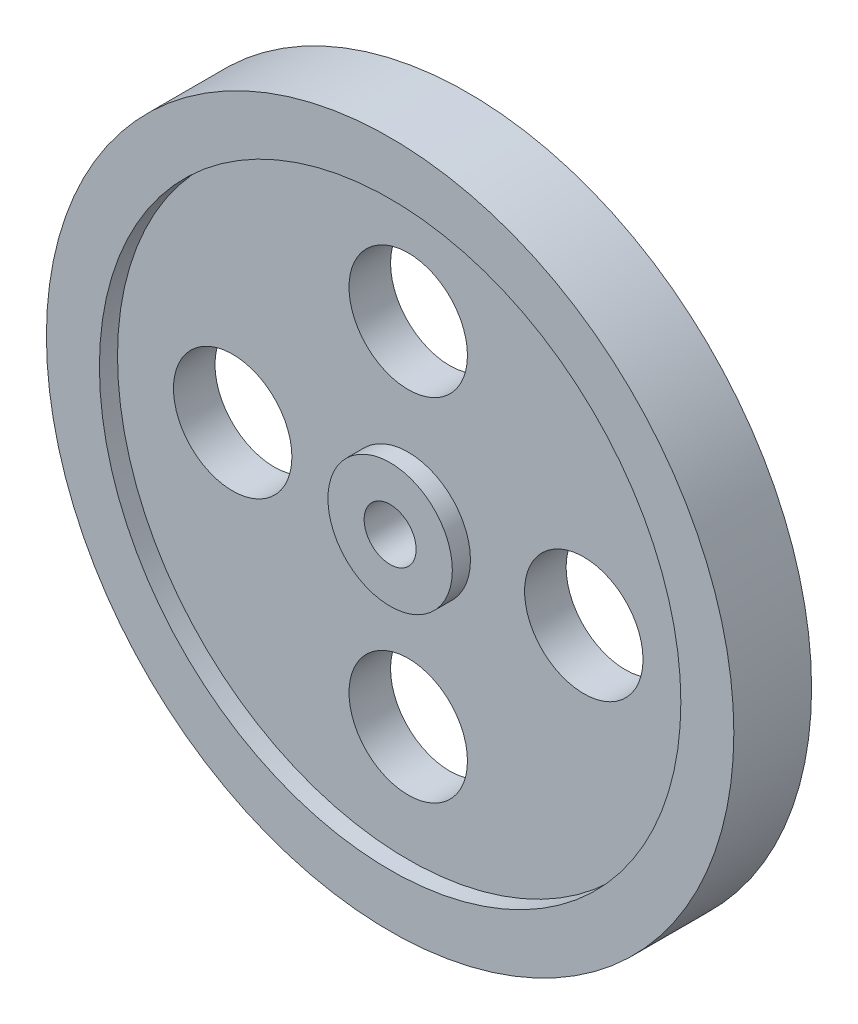
from build123d import *

# Parameters (mm, degrees)
SKETCH1_R           = 24.66826923
SKETCH1_R_2         = 1.8669
BOSS_EXTRUDE1_DEPTH = 2.79
SKETCH2_R           = 20.865
SKETCH2_R_2         = 4.465
CUT_EXTRUDE1_DEPTH  = 1.3
SKETCH3_R           = 4.25
CUT_EXTRUDE2_DEPTH  = 36.147765414


with BuildPart() as part:
    # Sketch1 → Boss-Extrude1 (new, symmetric)
    with BuildSketch(Plane.XY):
        Circle(SKETCH1_R)
        Circle(SKETCH1_R_2, mode=Mode.SUBTRACT)
    extrude(amount=BOSS_EXTRUDE1_DEPTH, both=True)

    # Sketch2 → Cut-Extrude1 (cut)
    with BuildSketch(Plane.XY.offset(2.79)):
        Circle(SKETCH2_R)
        Circle(SKETCH2_R_2, mode=Mode.SUBTRACT)
    cut_extrude1 = extrude(amount=-CUT_EXTRUDE1_DEPTH, mode=Mode.SUBTRACT)

    # Sketch3 → Cut-Extrude2 (cut, through all)
    with BuildSketch(Plane.XY.offset(1.49)):
        with Locations((0, 12.6)):
            Circle(SKETCH3_R)
        with Locations((12.6, 0)):
            Circle(SKETCH3_R)
        with Locations((0, -12.6)):
            Circle(SKETCH3_R)
        with Locations((-12.6, 0)):
            Circle(SKETCH3_R)
    extrude(amount=-CUT_EXTRUDE2_DEPTH, mode=Mode.SUBTRACT)

    # Mirror1: Cut-Extrude1 across plane
    add(cut_extrude1.mirror(Plane.XY), mode=Mode.SUBTRACT)


solid = part.part
